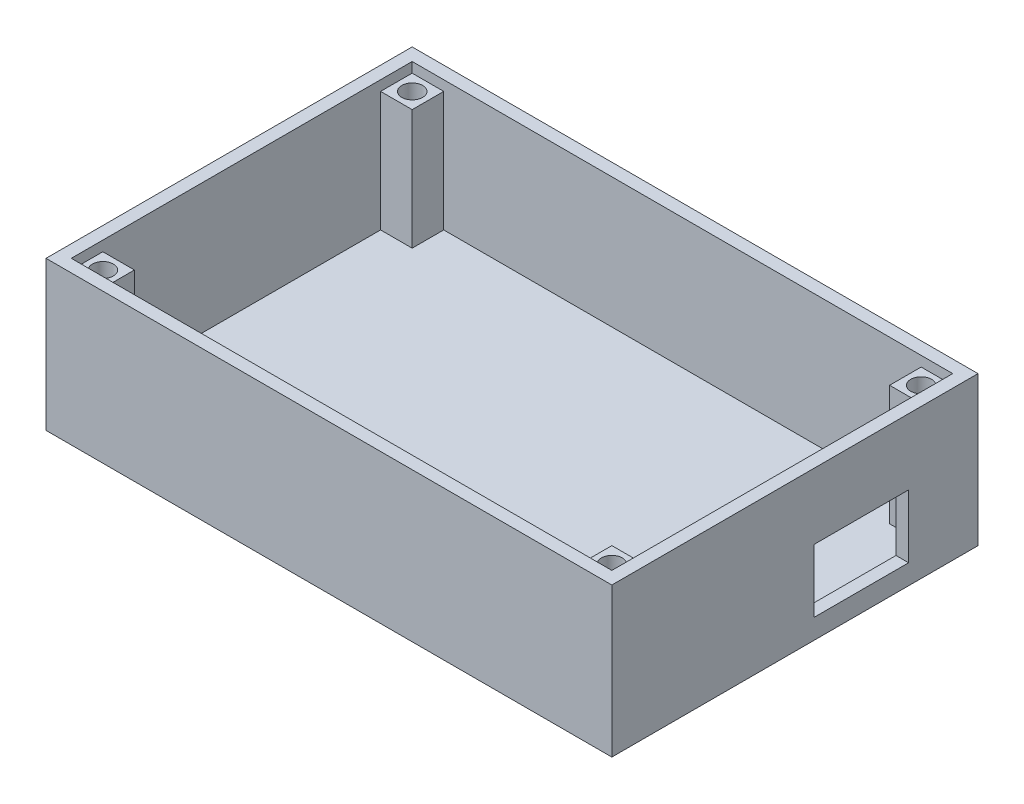
from build123d import *

# Parameters (mm, degrees)
SKETCH1_W             = 89.6
SKETCH1_H             = 57.98
SKETCH1_W_2           = 85.6
SKETCH1_H_2           = 53.98
BOSS_EXTRUDE1_DEPTH   = 20.6
SKETCH2_W             = 89.6
SKETCH2_H             = 57.98
BOSS_EXTRUDE2_DEPTH   = 3
SKETCH3_W             = 5
SKETCH3_H             = 5
BOSS_EXTRUDE3_DEPTH   = 19
BOSS_EXTRUDE3_2_DEPTH = 19
BOSS_EXTRUDE3_3_DEPTH = 19
BOSS_EXTRUDE3_4_DEPTH = 19
SKETCH4_R             = 1.65
CUT_EXTRUDE2_DEPTH    = 4
SKETCH5_W             = 15
SKETCH5_H             = 10
CUT_EXTRUDE3_DEPTH    = 4


with BuildPart() as part:
    # Sketch1 → Boss-Extrude1 (new body)
    with BuildSketch(Plane(origin=(0, 0, 0), x_dir=(1, 0, 0), z_dir=(0, 1, 0))):
        Rectangle(SKETCH1_W, SKETCH1_H)
        Rectangle(SKETCH1_W_2, SKETCH1_H_2, mode=Mode.SUBTRACT)
    extrude(amount=BOSS_EXTRUDE1_DEPTH)

    # Sketch2 → Boss-Extrude2 (add)
    with BuildSketch(Plane.XZ):
        Rectangle(SKETCH2_W, SKETCH2_H)
    extrude(amount=BOSS_EXTRUDE2_DEPTH)

    # Sketch5 → Cut-Extrude3 (cut)
    with BuildSketch(Plane(origin=(44.8, 0, 0), x_dir=(0, 0, -1), z_dir=(1, 0, 0))):
        with Locations((10.49990384, 5.151883102)):
            Rectangle(SKETCH5_W, SKETCH5_H)
    extrude(amount=-CUT_EXTRUDE3_DEPTH, mode=Mode.SUBTRACT)


with BuildPart() as body_2:
    # Sketch3 → Boss-Extrude3 (new body)
    with BuildSketch(Plane(origin=(0, 0, 0), x_dir=(1, 0, 0), z_dir=(0, 1, 0))):
        with Locations((40.3, 24.49)):
            Rectangle(SKETCH3_W, SKETCH3_H)
    extrude(amount=BOSS_EXTRUDE3_DEPTH)


with BuildPart() as body_3:
    # Sketch3 → Boss-Extrude3 2 (new body)
    with BuildSketch(Plane(origin=(0, 0, 0), x_dir=(1, 0, 0), z_dir=(0, 1, 0))):
        with Locations((-40.3, 24.49)):
            Rectangle(SKETCH3_W, SKETCH3_H)
    extrude(amount=BOSS_EXTRUDE3_2_DEPTH)


with BuildPart() as body_4:
    # Sketch3 → Boss-Extrude3 3 (new body)
    with BuildSketch(Plane(origin=(0, 0, 0), x_dir=(1, 0, 0), z_dir=(0, 1, 0))):
        with Locations((-40.3, -24.49)):
            Rectangle(SKETCH3_W, SKETCH3_H)
    extrude(amount=BOSS_EXTRUDE3_3_DEPTH)


with BuildPart() as body_5:
    # Sketch3 → Boss-Extrude3 4 (new body)
    with BuildSketch(Plane(origin=(0, 0, 0), x_dir=(1, 0, 0), z_dir=(0, 1, 0))):
        with Locations((40.3, -24.49)):
            Rectangle(SKETCH3_W, SKETCH3_H)
    extrude(amount=BOSS_EXTRUDE3_4_DEPTH)


with BuildPart() as cut_extrude2_tool:
    # Sketch4 → Cut-Extrude2 (new body)
    with BuildSketch(Plane(origin=(0, 19, 0), x_dir=(1, 0, 0), z_dir=(0, 1, 0))):
        with Locations(Location((-40.2908036, 24.48916763, 0), (0, 0, 270))):
            Circle(SKETCH4_R)
        with Locations(Location((40.29900386, 24.49016763, 0), (0, 0, 270))):
            Circle(SKETCH4_R)
        with Locations(Location((40.29900386, -24.49509047, 0), (0, 0, 270))):
            Circle(SKETCH4_R)
        with Locations(Location((-40.2908036, -24.49509047, 0), (0, 0, 270))):
            Circle(SKETCH4_R)
    extrude(amount=-CUT_EXTRUDE2_DEPTH)


with BuildPart() as body_2_1:
    add(body_2.part)

    # Cut-Extrude2: cut by cut_extrude2_tool
    add(cut_extrude2_tool.part, mode=Mode.SUBTRACT)


with BuildPart() as body_3_1:
    add(body_3.part)

    # Cut-Extrude2: cut by cut_extrude2_tool
    add(cut_extrude2_tool.part, mode=Mode.SUBTRACT)


with BuildPart() as body_4_1:
    add(body_4.part)

    # Cut-Extrude2: cut by cut_extrude2_tool
    add(cut_extrude2_tool.part, mode=Mode.SUBTRACT)


with BuildPart() as body_5_1:
    add(body_5.part)

    # Cut-Extrude2: cut by cut_extrude2_tool
    add(cut_extrude2_tool.part, mode=Mode.SUBTRACT)


solid = Compound([part.part, body_2_1.part, body_3_1.part, body_4_1.part, body_5_1.part])
